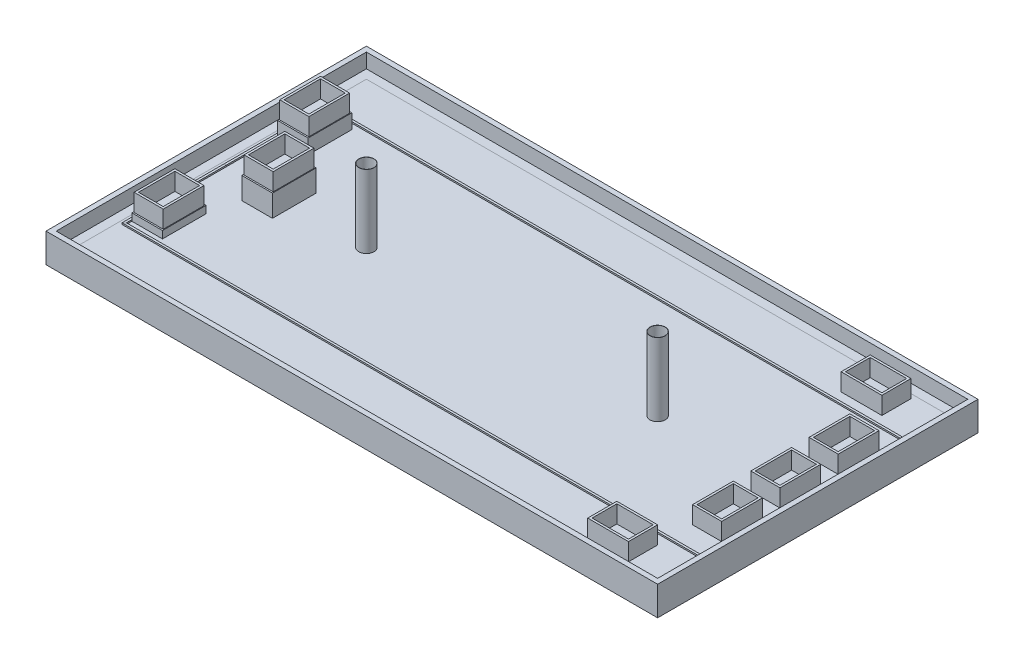
from build123d import *

# Parameters (mm, degrees)
SKETCH_1_W             = 4200
SKETCH_1_H             = 2200
EXTRUDE_1_DEPTH        = 100
SKETCH_2_W             = 4000
SKETCH_2_H             = 2000
EXTRUDE_2_DEPTH        = 3.5
SKETCH_3_W             = 4200
SKETCH_3_H             = 2200
SKETCH_3_W_2           = 4130
SKETCH_3_H_2           = 2130
EXTRUDE_4_DEPTH        = 100
SKETCH_4_W             = 210
SKETCH_4_H             = 300
EXTRUDE_5_DEPTH        = 100
SKETCH_4_4_W           = 210
SKETCH_4_4_H           = 300
EXTRUDE_6_DEPTH        = 150
SKETCH_4_5_W           = 210
SKETCH_4_5_H           = 300
EXTRUDE_7_DEPTH        = 50
SKETCH_7_R             = 52.5
SKETCH_7_R_2           = 51
EXTRUDE_8_DEPTH        = 500
SKETCH_8_W             = 280
SKETCH_8_H             = 200
SKETCH_8_W_2           = 250
SKETCH_8_H_2           = 170
EXTRUDE_9_DEPTH        = 120
SKETCH_9_W             = 200
SKETCH_9_H             = 280
SKETCH_9_W_2           = 170
SKETCH_9_H_2           = 250
EXTRUDE_10_DEPTH       = 120
PATTERN_LINEAR_1_COUNT = 3
PATTERN_LINEAR_1_PITCH = 400
SKETCH_10_W            = 200
SKETCH_10_H            = 280
SKETCH_10_W_2          = 170
SKETCH_10_H_2          = 250
EXTRUDE_11_DEPTH       = 120
SKETCH_11_W            = 200
SKETCH_11_H            = 280
SKETCH_11_W_2          = 170
SKETCH_11_H_2          = 250
EXTRUDE_12_DEPTH       = 120
SKETCH_12_W            = 200
SKETCH_12_H            = 280
SKETCH_12_W_2          = 170
SKETCH_12_H_2          = 250
EXTRUDE_13_DEPTH       = 120
SKETCH_24_W            = 15
SKETCH_24_H            = 10


with BuildPart() as part:
    # 草图1 → 凸台-拉伸1 (new body)
    with BuildSketch(Plane(origin=(0, 0, 0), x_dir=(1, 0, 0), z_dir=(0, 1, 0))):
        Rectangle(SKETCH_1_W, SKETCH_1_H)
    extrude(amount=EXTRUDE_1_DEPTH)

    # 草图2 → 凸台-拉伸2 (add)
    with BuildSketch(Plane(origin=(0, 100, 0), x_dir=(1, 0, 0), z_dir=(0, 1, 0))):
        Rectangle(SKETCH_2_W, SKETCH_2_H)
    extrude(amount=EXTRUDE_2_DEPTH)

    # 草图3 → 凸台-拉伸4 (add)
    with BuildSketch(Plane(origin=(0, 100, 0), x_dir=(1, 0, 0), z_dir=(0, 1, 0))):
        Rectangle(SKETCH_3_W, SKETCH_3_H)
        Rectangle(SKETCH_3_W_2, SKETCH_3_H_2, mode=Mode.SUBTRACT)
    extrude(amount=EXTRUDE_4_DEPTH)

    # 草图4 → 凸台-拉伸5 (add)
    with BuildSketch(Plane(origin=(0, 103.5, 0), x_dir=(1, 0, 0), z_dir=(0, 1, 0))):
        with Locations((-1855, 500)):
            Rectangle(SKETCH_4_W, SKETCH_4_H)
    extrude(amount=EXTRUDE_5_DEPTH)

    # 草图4<4> → 凸台-拉伸6 (add)
    with BuildSketch(Plane(origin=(0, 103.5, 0), x_dir=(1, 0, 0), z_dir=(0, 1, 0))):
        with Locations((-1600, 0)):
            Rectangle(SKETCH_4_4_W, SKETCH_4_4_H)
    extrude(amount=EXTRUDE_6_DEPTH)

    # 草图4<5> → 凸台-拉伸7 (add)
    with BuildSketch(Plane(origin=(0, 103.5, 0), x_dir=(1, 0, 0), z_dir=(0, 1, 0))):
        with Locations((-1855, -500)):
            Rectangle(SKETCH_4_5_W, SKETCH_4_5_H)
    extrude(amount=EXTRUDE_7_DEPTH)

    # 草图7 → 凸台-拉伸8 (add)
    with BuildSketch(Plane(origin=(0, 103.5, 0), x_dir=(1, 0, 0), z_dir=(0, 1, 0))):
        with Locations((-1000, 0)):
            Circle(SKETCH_7_R)
        with Locations((-1000, 0)):
            Circle(SKETCH_7_R_2, mode=Mode.SUBTRACT)
    extrude_8 = extrude(amount=EXTRUDE_8_DEPTH)

    # 镜向2: 凸台-拉伸8 across plane
    add(extrude_8.mirror(Plane(origin=(0, 0, 0), x_dir=(0, 0, 1), z_dir=(1, 0, 0))))

    # 草图8 → 凸台-拉伸9 (add)
    with BuildSketch(Plane(origin=(0, 103.5, 0), x_dir=(1, 0, 0), z_dir=(0, 1, 0))):
        with Locations((1630, 870)):
            Rectangle(SKETCH_8_W, SKETCH_8_H)
        with Locations((1630, 870)):
            Rectangle(SKETCH_8_W_2, SKETCH_8_H_2, mode=Mode.SUBTRACT)
    extrude_9 = extrude(amount=EXTRUDE_9_DEPTH)

    # 草图9 → 凸台-拉伸10 (add)
    with BuildSketch(Plane(origin=(0, 103.5, 0), x_dir=(1, 0, 0), z_dir=(0, 1, 0))):
        with Locations((1870, 410)):
            Rectangle(SKETCH_9_W, SKETCH_9_H)
        with Locations((1870, 410)):
            Rectangle(SKETCH_9_W_2, SKETCH_9_H_2, mode=Mode.SUBTRACT)
    extrude_10 = extrude(amount=EXTRUDE_10_DEPTH)

    # 阵列(线性)1: 凸台-拉伸10 ×3
    with Locations(*[(0, 0, i * PATTERN_LINEAR_1_PITCH) for i in range(1, PATTERN_LINEAR_1_COUNT)]):
        add(extrude_10)

    # 镜向3: 凸台-拉伸9 across plane
    add(extrude_9.mirror(Plane.XY))

    # 草图10 → 凸台-拉伸11 (add)
    with BuildSketch(Plane(origin=(0, 203.5, 0), x_dir=(1, 0, 0), z_dir=(0, 1, 0))):
        with Locations((-1855, 500)):
            Rectangle(SKETCH_10_W, SKETCH_10_H)
        with Locations((-1855, 500)):
            Rectangle(SKETCH_10_W_2, SKETCH_10_H_2, mode=Mode.SUBTRACT)
    extrude(amount=EXTRUDE_11_DEPTH)

    # 草图11 → 凸台-拉伸12 (add)
    with BuildSketch(Plane(origin=(0, 253.5, 0), x_dir=(1, 0, 0), z_dir=(0, 1, 0))):
        with Locations((-1600, 0)):
            Rectangle(SKETCH_11_W, SKETCH_11_H)
        with Locations((-1600, 0)):
            Rectangle(SKETCH_11_W_2, SKETCH_11_H_2, mode=Mode.SUBTRACT)
    extrude(amount=EXTRUDE_12_DEPTH)

    # 草图12 → 凸台-拉伸13 (add)
    with BuildSketch(Plane(origin=(0, 153.5, 0), x_dir=(1, 0, 0), z_dir=(0, 1, 0))):
        with Locations((-1855, -500)):
            Rectangle(SKETCH_12_W, SKETCH_12_H)
        with Locations((-1855, -500)):
            Rectangle(SKETCH_12_W_2, SKETCH_12_H_2, mode=Mode.SUBTRACT)
    extrude(amount=EXTRUDE_13_DEPTH)

    # 扫描2: sweep along a path in 草图23
    with BuildLine(Plane(origin=(0, 103.5, 0), x_dir=(1, 0, 0), z_dir=(0, 1, 0))) as sweep_2_path:
        Line((2000, -703), (-1975, -703))
        Line((-1975, -703), (-1975, 703))
        Line((-1975, 703), (2000, 703))
        Line((2000, 703), (2000, -703))
    # 草图24 → 扫描2 (sweep)
    with BuildSketch(Plane.XY):
        with Locations((-1967.5, 108.5)):
            Rectangle(SKETCH_24_W, SKETCH_24_H)
    sweep(path=sweep_2_path.line, transition=Transition.RIGHT)


solid = part.part
